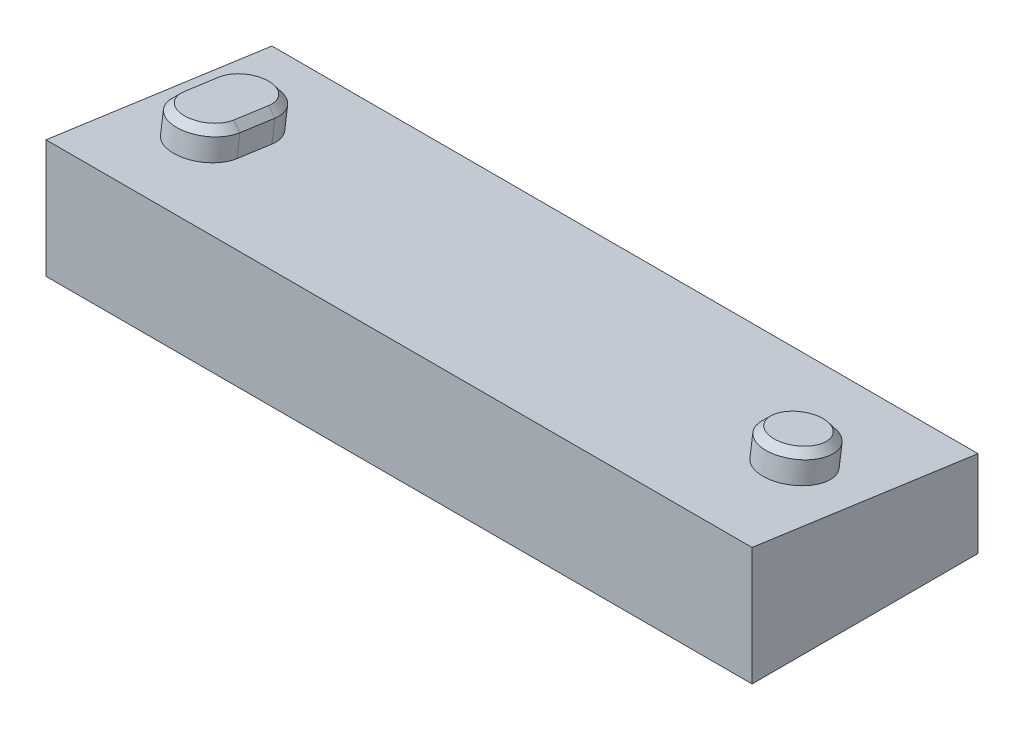
from build123d import *

# Parameters (mm, degrees)
EXTRUDE_1_DEPTH     = 16
CUT_EXTRUDE_1_DEPTH = 50
EXTRUDE_2_DEPTH     = 28.5
SKETCH_4_R          = 4.5
CUT_EXTRUDE_2_DEPTH = 28.5
EXTRUDE_3_DEPTH     = 50
EXTRUDE_START       = 4
SKETCH_6_R          = 4.5
EXTRUDE_4_DEPTH     = 4
CUT_EXTRUDE_3_DEPTH = 60
CHAMFER_1_SIZE      = 1


with BuildPart() as part:
    # 草图1 → 凸台-拉伸1 (new, symmetric)
    with BuildSketch(Plane.XY):
        with BuildLine():
            Line((-17, -12.990381057), (-17, -66.86388681))
            Line((-17, -66.86388681), (-20.5, -66.86388681))
            Line((-20.5, -66.86388681), (-20.5, -12.990381057))
            ThreePointArc((-20.5, -12.990381057), (-17.809307341, -9.210736327), (-13.357142857, -10.51602276))
            ThreePointArc((-13.357142857, -10.51602276), (0, -17), (13.357142857, -10.51602276))
            ThreePointArc((13.357142857, -10.51602276), (17.809307341, -9.210736327), (20.5, -12.990381057))
            Line((20.5, -12.990381057), (20.5, -66.86388681))
            Line((20.5, -66.86388681), (17, -66.86388681))
            Line((17, -66.86388681), (17, -12.990381057))
            ThreePointArc((17, -12.990381057), (16.663663418, -12.517925466), (16.107142857, -12.68108627))
            ThreePointArc((16.107142857, -12.68108627), (0, -20.5), (-16.107142857, -12.68108627))
            ThreePointArc((-16.107142857, -12.68108627), (-16.663663418, -12.517925466), (-17, -12.990381057))
        make_face()
    extrude(amount=EXTRUDE_1_DEPTH, both=True)

    # 草图2 → 切除-拉伸1 (cut, symmetric)
    with BuildSketch(Plane(origin=(0, 0, 0), x_dir=(0, 0, -1), z_dir=(1, 0, 0))):
        Polygon((16, -60.748653355), (-16, -56.251346645), (-16, -66.86388681), (16, -66.86388681), align=None)
    extrude(amount=CUT_EXTRUDE_1_DEPTH, both=True, mode=Mode.SUBTRACT)

    # 草图3 → 凸台-拉伸2 (add)
    with BuildSketch(Plane.ZY.offset(20.5)):
        Polygon((-16, -60.748653355), (16, -56.251346645), (16, -52.716950141), (-16, -57.214256851), align=None)
    extrude_2 = extrude(amount=EXTRUDE_2_DEPTH)

    # 镜向1: 凸台-拉伸2 across plane
    add(extrude_2.mirror(Plane(origin=(0, 0, 0), x_dir=(0, 0, 1), z_dir=(1, 0, 0))))

    # 草图4 → 切除-拉伸2 (cut)
    with BuildSketch(Plane(origin=(0, -53.900966366, 7.575286804), x_dir=(1, 0, 0), z_dir=(0, 0.9902680687415715, -0.13917310096005808))):
        with Locations(Location((40.5, 7.649733485, 0), (0, 0, 270))):
            Circle(SKETCH_4_R)
        with BuildLine():
            Line((-36, 10.149733485), (-36, 5.149733485))
            ThreePointArc((-36, 5.149733485), (-40.5, 0.649733485), (-45, 5.149733485))
            Line((-45, 5.149733485), (-45, 10.149733485))
            ThreePointArc((-45, 10.149733485), (-40.5, 14.649733485), (-36, 10.149733485))
        make_face()
    extrude(amount=-CUT_EXTRUDE_2_DEPTH, mode=Mode.SUBTRACT)

    # 草图7 → 切除-拉伸3 (cut, symmetric)
    with BuildSketch(Plane(origin=(0, 0, 0), x_dir=(0, 0, -1), z_dir=(1, 0, 0))):
        Polygon((16, -60.748653355), (-16, -56.251346645), (-16, 0), (16, 0), align=None)
    extrude(amount=CUT_EXTRUDE_3_DEPTH, both=True, mode=Mode.SUBTRACT)


with BuildPart() as body_2:
    # 草图5 → 凸台-拉伸3 (new, symmetric)
    with BuildSketch(Plane(origin=(0, 0, 0), x_dir=(0, 0, -1), z_dir=(1, 0, 0))):
        Polygon((-16, -56.251346645), (16, -60.748653355), (16, -72.998653355), (-16, -72.998653355), align=None)
    extrude(amount=EXTRUDE_3_DEPTH, both=True)

    # 草图6 → 凸台-拉伸4 (add)
    with BuildSketch(Plane(origin=(0, -57.366904606, 8.062392658), x_dir=(1, 0, 0), z_dir=(0, 0.9902680687415714, -0.13917310096005842)).offset(EXTRUDE_START)):
        with Locations(Location((40.5, 7.649733485, 0), (0, 0, 90))):
            Circle(SKETCH_6_R)
        with BuildLine():
            Line((-36, 5.149733485), (-36, 10.149733485))
            ThreePointArc((-36, 10.149733485), (-40.5, 14.649733485), (-45, 10.149733485))
            Line((-45, 10.149733485), (-45, 5.149733485))
            ThreePointArc((-45, 5.149733485), (-40.5, 0.649733485), (-36, 5.149733485))
        make_face()
    extrude(amount=-EXTRUDE_4_DEPTH)

    # 倒角1
    chamfer_1_edges = [body_2.edges().sort_by_distance(p)[0] for p in [
        (-40.5, -55.444681169, -7.001463032),
        (-45, -54.470469462, -0.06958655),
        (-40.5, -53.496257755, 6.862289931),
        (-36, -54.470469462, -0.06958655),
        (40.5, -53.844190507, 4.386619759),
    ]]
    chamfer(chamfer_1_edges, length=CHAMFER_1_SIZE)


solid = body_2.part
